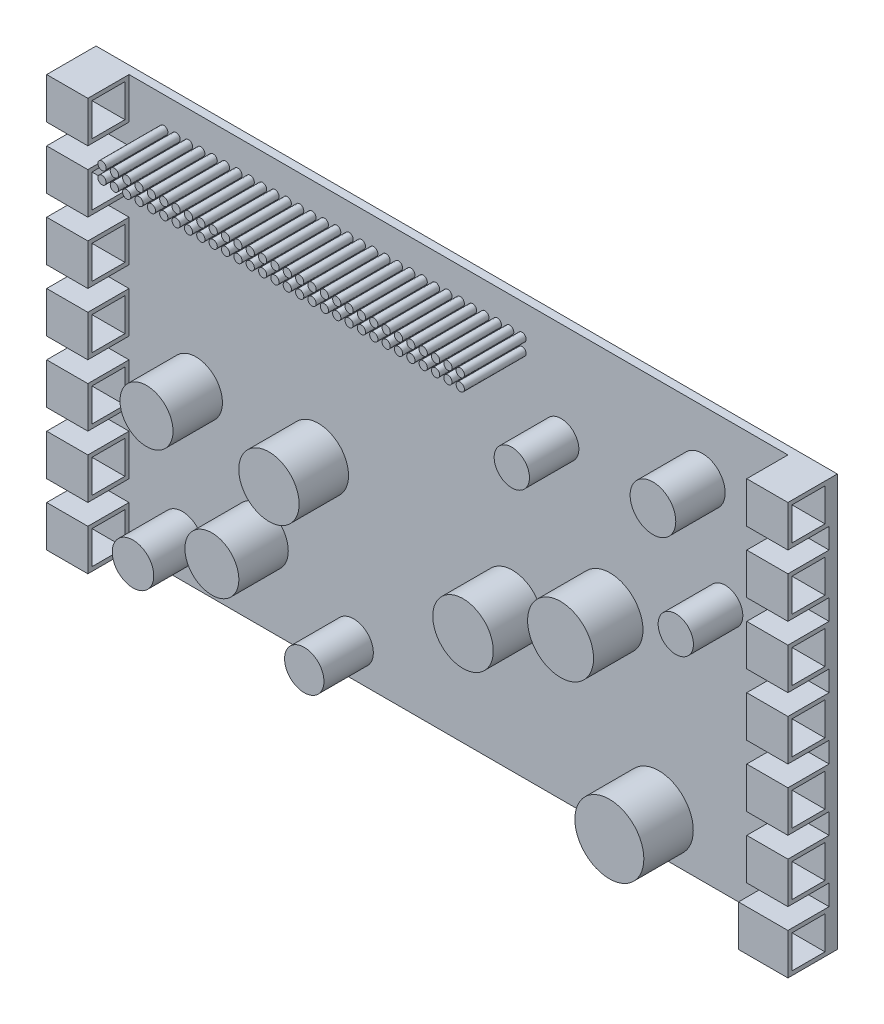
from build123d import *

# Parameters (mm, degrees)
SKETCH_1_W                 = 180
SKETCH_1_H                 = 100
EXTRUDE_1_DEPTH            = 2
SKETCH_4_W                 = 10
SKETCH_4_H                 = 10
SKETCH_4_W_2               = 8
SKETCH_4_H_2               = 8
EXTRUDE_2_DEPTH            = 10
SKETCH_5_W                 = 10
SKETCH_5_H                 = 10
EXTRUDE_3_DEPTH            = 2
PATTERN_LINEAR_1_COUNT     = 7
PATTERN_LINEAR_1_PITCH     = 15
MIRROR_1_COPY_1_SKETCH_W   = 10
MIRROR_1_COPY_1_SKETCH_H   = 10
MIRROR_1_COPY_1_SKETCH_W_2 = 8
MIRROR_1_COPY_1_SKETCH_H_2 = 8
MIRROR_1_COPY_1_DEPTH      = 10
MIRROR_1_COPY_2_SKETCH_W   = 10
MIRROR_1_COPY_2_SKETCH_H   = 10
MIRROR_1_COPY_2_SKETCH_W_2 = 8
MIRROR_1_COPY_2_SKETCH_H_2 = 8
MIRROR_1_COPY_2_DEPTH      = 10
MIRROR_1_COPY_3_SKETCH_W   = 10
MIRROR_1_COPY_3_SKETCH_H   = 10
MIRROR_1_COPY_3_SKETCH_W_2 = 8
MIRROR_1_COPY_3_SKETCH_H_2 = 8
MIRROR_1_COPY_3_DEPTH      = 10
MIRROR_1_COPY_4_SKETCH_W   = 10
MIRROR_1_COPY_4_SKETCH_H   = 10
MIRROR_1_COPY_4_SKETCH_W_2 = 8
MIRROR_1_COPY_4_SKETCH_H_2 = 8
MIRROR_1_COPY_4_DEPTH      = 10
MIRROR_1_COPY_5_SKETCH_W   = 10
MIRROR_1_COPY_5_SKETCH_H   = 10
MIRROR_1_COPY_5_SKETCH_W_2 = 8
MIRROR_1_COPY_5_SKETCH_H_2 = 8
MIRROR_1_COPY_5_DEPTH      = 10
MIRROR_1_COPY_6_SKETCH_W   = 10
MIRROR_1_COPY_6_SKETCH_H   = 10
MIRROR_1_COPY_6_SKETCH_W_2 = 8
MIRROR_1_COPY_6_SKETCH_H_2 = 8
MIRROR_1_COPY_6_DEPTH      = 10
SKETCH_6_R                 = 5.040246544
SKETCH_6_R_2               = 6.552320507
SKETCH_6_R_3               = 4.781597714
SKETCH_6_R_4               = 7.325717032
SKETCH_6_R_5               = 6.439888906
SKETCH_6_R_6               = 7.343497745
SKETCH_6_R_7               = 4.284209562
SKETCH_6_R_8               = 8.00907705
SKETCH_6_R_9               = 8.377277925
SKETCH_6_R_10              = 5.544271198
EXTRUDE_4_DEPTH            = 12
SKETCH_7_R                 = 1
EXTRUDE_5_DEPTH            = 15
SCALE_1_SCALE              = 0.5


with BuildPart() as part:
    # 草图1 → 凸台-拉伸1 (new body)
    with BuildSketch(Plane.XY):
        Rectangle(SKETCH_1_W, SKETCH_1_H)
    extrude(amount=EXTRUDE_1_DEPTH)

    # 草图4 → 凸台-拉伸2 (add)
    with BuildSketch(Plane(origin=(90, 0, 0), x_dir=(0, 0, -1), z_dir=(1, 0, 0))):
        with Locations((-7, -45)):
            Rectangle(SKETCH_4_W, SKETCH_4_H)
        with Locations((-7, -45)):
            Rectangle(SKETCH_4_W_2, SKETCH_4_H_2, mode=Mode.SUBTRACT)
    extrude_2 = extrude(amount=-EXTRUDE_2_DEPTH)

    # 草图5 → 凸台-拉伸3 (add)
    with BuildSketch(Plane.ZY.offset(-80)):
        with Locations((7, -45)):
            Rectangle(SKETCH_5_W, SKETCH_5_H)
    extrude(amount=EXTRUDE_3_DEPTH)

    # 阵列(线性)1: 凸台-拉伸2 ×7
    with Locations(*[(0, i * PATTERN_LINEAR_1_PITCH, 0) for i in range(1, PATTERN_LINEAR_1_COUNT)]):
        add(extrude_2)

    # 镜向1: 凸台-拉伸2 across plane
    add(extrude_2.mirror(Plane(origin=(0, 0, 0), x_dir=(0, 0, 1), z_dir=(1, 0, 0))))

    # 镜向1 copy 1 sketch → 镜向1 copy 1 (add)
    with BuildSketch(Plane(origin=(-90, 15, 0), x_dir=(0, 0, -1), z_dir=(-1, 0, 0))):
        with Locations((-7, 45)):
            Rectangle(MIRROR_1_COPY_1_SKETCH_W, MIRROR_1_COPY_1_SKETCH_H)
        with Locations((-7, 45)):
            Rectangle(MIRROR_1_COPY_1_SKETCH_W_2, MIRROR_1_COPY_1_SKETCH_H_2, mode=Mode.SUBTRACT)
    extrude(amount=-MIRROR_1_COPY_1_DEPTH)

    # 镜向1 copy 2 sketch → 镜向1 copy 2 (add)
    with BuildSketch(Plane(origin=(-90, 30, 0), x_dir=(0, 0, -1), z_dir=(-1, 0, 0))):
        with Locations((-7, 45)):
            Rectangle(MIRROR_1_COPY_2_SKETCH_W, MIRROR_1_COPY_2_SKETCH_H)
        with Locations((-7, 45)):
            Rectangle(MIRROR_1_COPY_2_SKETCH_W_2, MIRROR_1_COPY_2_SKETCH_H_2, mode=Mode.SUBTRACT)
    extrude(amount=-MIRROR_1_COPY_2_DEPTH)

    # 镜向1 copy 3 sketch → 镜向1 copy 3 (add)
    with BuildSketch(Plane(origin=(-90, 45, 0), x_dir=(0, 0, -1), z_dir=(-1, 0, 0))):
        with Locations((-7, 45)):
            Rectangle(MIRROR_1_COPY_3_SKETCH_W, MIRROR_1_COPY_3_SKETCH_H)
        with Locations((-7, 45)):
            Rectangle(MIRROR_1_COPY_3_SKETCH_W_2, MIRROR_1_COPY_3_SKETCH_H_2, mode=Mode.SUBTRACT)
    extrude(amount=-MIRROR_1_COPY_3_DEPTH)

    # 镜向1 copy 4 sketch → 镜向1 copy 4 (add)
    with BuildSketch(Plane(origin=(-90, 60, 0), x_dir=(0, 0, -1), z_dir=(-1, 0, 0))):
        with Locations((-7, 45)):
            Rectangle(MIRROR_1_COPY_4_SKETCH_W, MIRROR_1_COPY_4_SKETCH_H)
        with Locations((-7, 45)):
            Rectangle(MIRROR_1_COPY_4_SKETCH_W_2, MIRROR_1_COPY_4_SKETCH_H_2, mode=Mode.SUBTRACT)
    extrude(amount=-MIRROR_1_COPY_4_DEPTH)

    # 镜向1 copy 5 sketch → 镜向1 copy 5 (add)
    with BuildSketch(Plane(origin=(-90, 75, 0), x_dir=(0, 0, -1), z_dir=(-1, 0, 0))):
        with Locations((-7, 45)):
            Rectangle(MIRROR_1_COPY_5_SKETCH_W, MIRROR_1_COPY_5_SKETCH_H)
        with Locations((-7, 45)):
            Rectangle(MIRROR_1_COPY_5_SKETCH_W_2, MIRROR_1_COPY_5_SKETCH_H_2, mode=Mode.SUBTRACT)
    extrude(amount=-MIRROR_1_COPY_5_DEPTH)

    # 镜向1 copy 6 sketch → 镜向1 copy 6 (add)
    with BuildSketch(Plane(origin=(-90, 90, 0), x_dir=(0, 0, -1), z_dir=(-1, 0, 0))):
        with Locations((-7, 45)):
            Rectangle(MIRROR_1_COPY_6_SKETCH_W, MIRROR_1_COPY_6_SKETCH_H)
        with Locations((-7, 45)):
            Rectangle(MIRROR_1_COPY_6_SKETCH_W_2, MIRROR_1_COPY_6_SKETCH_H_2, mode=Mode.SUBTRACT)
    extrude(amount=-MIRROR_1_COPY_6_DEPTH)

    # 草图6 → 凸台-拉伸4 (add)
    with BuildSketch(Plane.XY.offset(2)):
        with Locations((-67.035279032, -40.447978514)):
            Circle(SKETCH_6_R)
        with Locations((-47.882342166, -30.87151008)):
            Circle(SKETCH_6_R_2)
        with Locations((-25.453245046, -41.960052477)):
            Circle(SKETCH_6_R_3)
        with Locations((-34.02166417, -7.686375979)):
            Circle(SKETCH_6_R_4)
        with Locations((-63.759118778, -7.686375979)):
            Circle(SKETCH_6_R_5)
        with Locations((13.104641014, -15.012093011)):
            Circle(SKETCH_6_R_6)
        with Locations((24.949220392, 25.831263537)):
            Circle(SKETCH_6_R_7)
        with Locations((36.793799769, -4.410215726)):
            Circle(SKETCH_6_R_8)
        with Locations((48.638379147, -40.447978514)):
            Circle(SKETCH_6_R_9)
        with Locations((59.222896889, 34.399682661)):
            Circle(SKETCH_6_R_10)
        with Locations((64.767168087, 10.710523905)):
            Circle(SKETCH_6_R_7)
    extrude(amount=EXTRUDE_4_DEPTH)

    # 草图7 → 凸台-拉伸5 (add)
    with BuildSketch(Plane.XY.offset(2)):
        with Locations((-71.565773368, 39.531570051)):
            Circle(SKETCH_7_R)
        with Locations((-68.565773368, 39.531570051)):
            Circle(SKETCH_7_R)
        with Locations((-65.565773368, 39.531570051)):
            Circle(SKETCH_7_R)
        with Locations((-62.565773368, 39.531570051)):
            Circle(SKETCH_7_R)
        with Locations((-59.565773368, 39.531570051)):
            Circle(SKETCH_7_R)
        with Locations((-56.565773368, 39.531570051)):
            Circle(SKETCH_7_R)
        with Locations((-53.565773368, 39.531570051)):
            Circle(SKETCH_7_R)
        with Locations((-50.565773368, 39.531570051)):
            Circle(SKETCH_7_R)
        with Locations((-47.565773368, 39.531570051)):
            Circle(SKETCH_7_R)
        with Locations((-44.565773368, 39.531570051)):
            Circle(SKETCH_7_R)
        with Locations((-41.565773368, 39.531570051)):
            Circle(SKETCH_7_R)
        with Locations((-38.565773368, 39.531570051)):
            Circle(SKETCH_7_R)
        with Locations((-35.565773368, 39.531570051)):
            Circle(SKETCH_7_R)
        with Locations((-32.565773368, 39.531570051)):
            Circle(SKETCH_7_R)
        with Locations((-29.565773368, 39.531570051)):
            Circle(SKETCH_7_R)
        with Locations((-26.565773368, 39.531570051)):
            Circle(SKETCH_7_R)
        with Locations((-23.565773368, 39.531570051)):
            Circle(SKETCH_7_R)
        with Locations((-20.565773368, 39.531570051)):
            Circle(SKETCH_7_R)
        with Locations((-17.565773368, 39.531570051)):
            Circle(SKETCH_7_R)
        with Locations((-14.565773368, 39.531570051)):
            Circle(SKETCH_7_R)
        with Locations((-11.565773368, 39.531570051)):
            Circle(SKETCH_7_R)
        with Locations((-8.565773368, 39.531570051)):
            Circle(SKETCH_7_R)
        with Locations((-5.565773368, 39.531570051)):
            Circle(SKETCH_7_R)
        with Locations((-2.565773368, 39.531570051)):
            Circle(SKETCH_7_R)
        with Locations((0.434226632, 39.531570051)):
            Circle(SKETCH_7_R)
        with Locations((3.434226632, 39.531570051)):
            Circle(SKETCH_7_R)
        with Locations((6.434226632, 39.531570051)):
            Circle(SKETCH_7_R)
        with Locations((9.434226632, 39.531570051)):
            Circle(SKETCH_7_R)
        with Locations((12.434226632, 39.531570051)):
            Circle(SKETCH_7_R)
        with Locations((15.434226632, 39.531570051)):
            Circle(SKETCH_7_R)
        with Locations((-68.565773368, 42.531570051)):
            Circle(SKETCH_7_R)
        with Locations((-65.565773368, 42.531570051)):
            Circle(SKETCH_7_R)
        with Locations((-62.565773368, 42.531570051)):
            Circle(SKETCH_7_R)
        with Locations((-59.565773368, 42.531570051)):
            Circle(SKETCH_7_R)
        with Locations((-56.565773368, 42.531570051)):
            Circle(SKETCH_7_R)
        with Locations((-53.565773368, 42.531570051)):
            Circle(SKETCH_7_R)
        with Locations((-50.565773368, 42.531570051)):
            Circle(SKETCH_7_R)
        with Locations((-47.565773368, 42.531570051)):
            Circle(SKETCH_7_R)
        with Locations((-44.565773368, 42.531570051)):
            Circle(SKETCH_7_R)
        with Locations((-41.565773368, 42.531570051)):
            Circle(SKETCH_7_R)
        with Locations((-38.565773368, 42.531570051)):
            Circle(SKETCH_7_R)
        with Locations((-35.565773368, 42.531570051)):
            Circle(SKETCH_7_R)
        with Locations((-32.565773368, 42.531570051)):
            Circle(SKETCH_7_R)
        with Locations((-29.565773368, 42.531570051)):
            Circle(SKETCH_7_R)
        with Locations((-26.565773368, 42.531570051)):
            Circle(SKETCH_7_R)
        with Locations((-23.565773368, 42.531570051)):
            Circle(SKETCH_7_R)
        with Locations((-20.565773368, 42.531570051)):
            Circle(SKETCH_7_R)
        with Locations((-17.565773368, 42.531570051)):
            Circle(SKETCH_7_R)
        with Locations((-14.565773368, 42.531570051)):
            Circle(SKETCH_7_R)
        with Locations((-11.565773368, 42.531570051)):
            Circle(SKETCH_7_R)
        with Locations((-8.565773368, 42.531570051)):
            Circle(SKETCH_7_R)
        with Locations((-5.565773368, 42.531570051)):
            Circle(SKETCH_7_R)
        with Locations((-2.565773368, 42.531570051)):
            Circle(SKETCH_7_R)
        with Locations((0.434226632, 42.531570051)):
            Circle(SKETCH_7_R)
        with Locations((3.434226632, 42.531570051)):
            Circle(SKETCH_7_R)
        with Locations((6.434226632, 42.531570051)):
            Circle(SKETCH_7_R)
        with Locations((9.434226632, 42.531570051)):
            Circle(SKETCH_7_R)
        with Locations((12.434226632, 42.531570051)):
            Circle(SKETCH_7_R)
        with Locations((15.434226632, 42.531570051)):
            Circle(SKETCH_7_R)
        with Locations((-71.565773368, 42.531570051)):
            Circle(SKETCH_7_R)
    extrude(amount=EXTRUDE_5_DEPTH)


with BuildPart() as part_1:
    # 缩放比例1: scaled about (-0.34088163, -2.115423583, 3.834166542)
    add(part.part.scale(SCALE_1_SCALE).moved(Location((-0.170440815, -1.057711792, 1.917083271))))


solid = part_1.part
